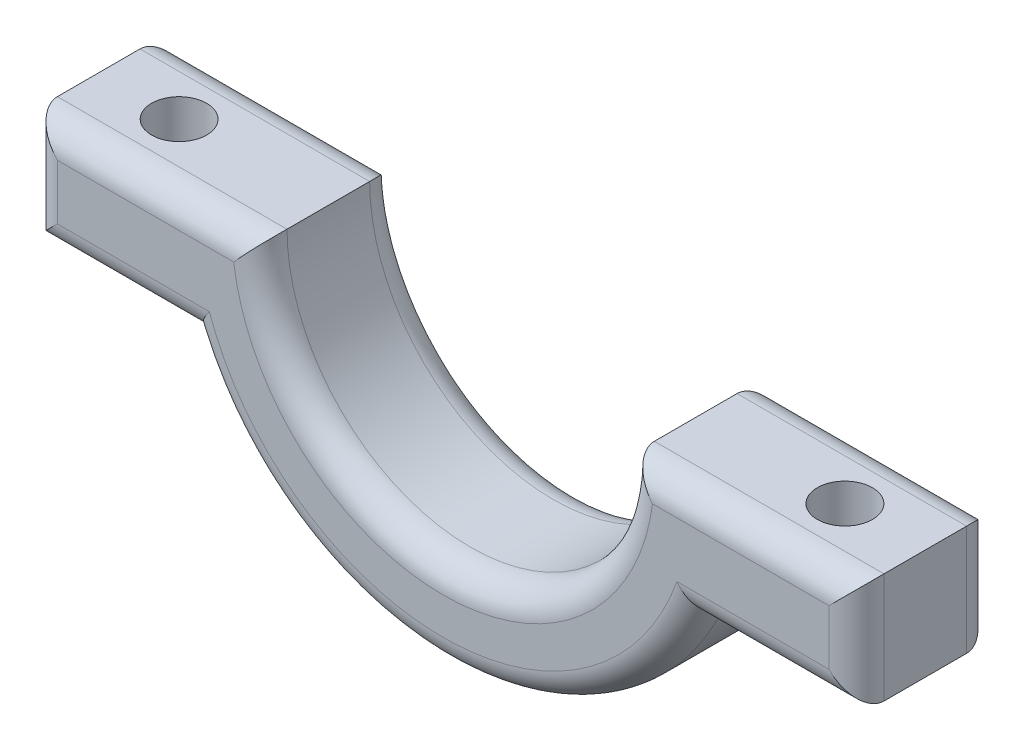
from build123d import *

# Parameters (mm, degrees)
BOSS_EXTRUDE1_DEPTH   = 7.5
FILLET2_R             = 3
F_6_0MM_DOWEL_HOLE1_D = 6


with BuildPart() as part:
    # Sketch1 → Boss-Extrude1 (new, symmetric)
    with BuildSketch(Plane.XY):
        with BuildLine():
            Line((-20, 0), (-45, 0))
            Line((-45, 0), (-45, -12))
            Line((-45, -12), (-27.49545417, -12))
            ThreePointArc((-27.49545417, -12), (0, -30), (27.49545417, -12))
            Line((27.49545417, -12), (45, -12))
            Line((45, -12), (45, 0))
            Line((45, 0), (20, 0))
            ThreePointArc((20, 0), (0, -20), (-20, 0))
        make_face()
    extrude(amount=BOSS_EXTRUDE1_DEPTH, both=True)

    # Fillet2
    fillet2_edges = [part.edges().sort_by_distance(p)[0] for p in [
        (-36.247727085, -12, -7.5),
        (-45, -6, -7.5),
        (-32.5, 0, -7.5),
        (0, -20, -7.5),
        (-45, -6, 7.5),
        (-36.247727085, -12, 7.5),
        (0, -30, 7.5),
        (36.247727085, -12, 7.5),
        (45, -6, 7.5),
        (32.5, 0, 7.5),
        (0, -20, 7.5),
        (32.5, 0, -7.5),
        (-32.5, 0, 7.5),
        (45, -6, -7.5),
        (36.247727085, -12, -7.5),
        (0, -30, -7.5),
    ]]
    fillet(fillet2_edges, radius=FILLET2_R)

    # Ø6.0mm Dowel Hole1 (through all)
    with Locations(Plane(origin=(0, -12, 0), x_dir=(-1, 0, 0), z_dir=(0, -1, 0))):
        with Locations((36.247727085, 0), (-36.247727085, 0)):
            Hole(F_6_0MM_DOWEL_HOLE1_D / 2)


solid = part.part
